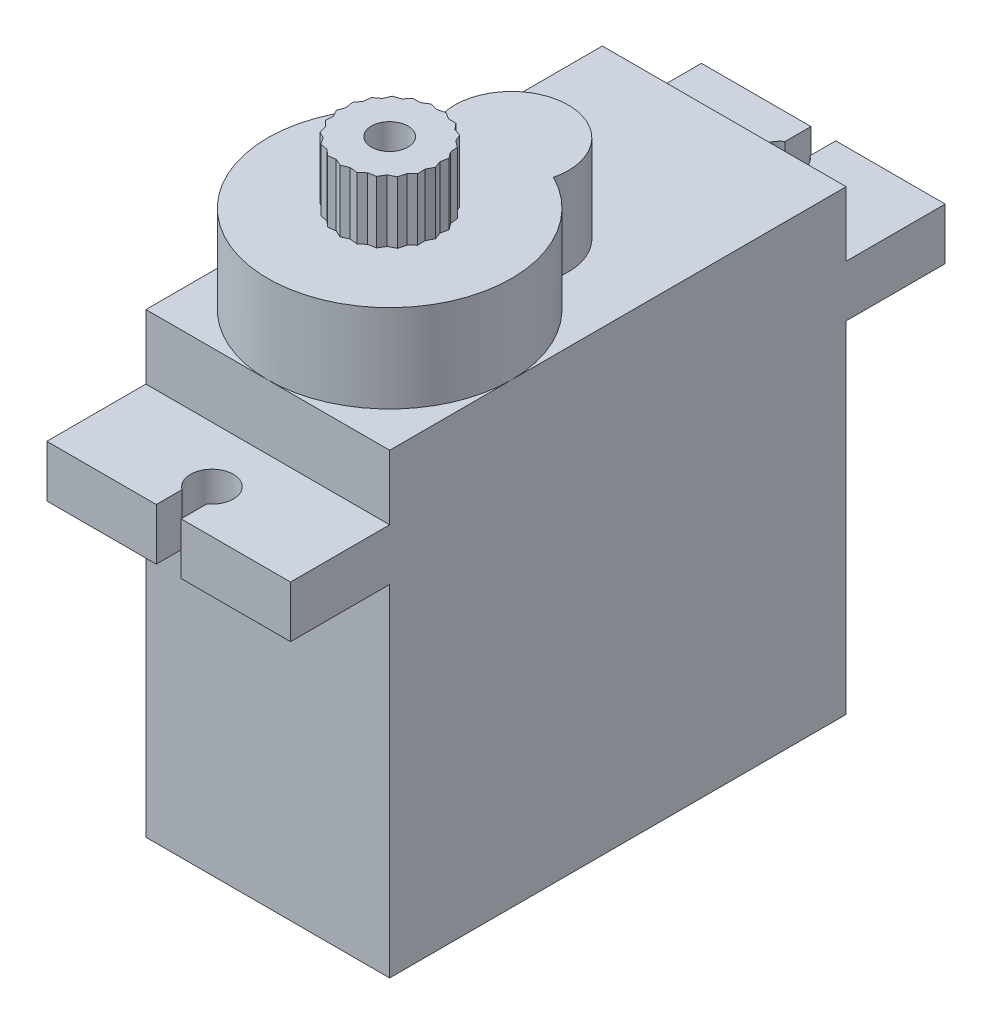
from build123d import *

# Parameters (mm, degrees)
BOSS_EXTRUDE1_DEPTH = 5.9944
BOSS_EXTRUDE2_DEPTH = 4.318
BOSS_EXTRUDE3_DEPTH = 3.048
CIRPATTERN1_COUNT   = 21
SKETCH4_R           = 0.9
CUT_EXTRUDE1_DEPTH  = 6
CUT_EXTRUDE2_REACH  = 35.989


with BuildPart() as part:
    # Sketch1 → Boss-Extrude1 (new, symmetric)
    with BuildSketch(Plane(origin=(0, 0, 0), x_dir=(0, 0, -1), z_dir=(1, 0, 0))):
        Polygon((22.45, 16.764), (27.325, 16.764), (27.325, 19.304), (22.45, 19.304), (22.45, 22.479), (0, 22.479), (0, 19.304), (-4.875, 19.304), (-4.875, 16.764), (0, 16.764), (0, 0), (22.45, 0), align=None)
    extrude(amount=BOSS_EXTRUDE1_DEPTH, both=True)

    # Sketch2 → Boss-Extrude2 (add)
    with BuildSketch(Plane(origin=(0, 22.479, 0), x_dir=(1, 0, 0), z_dir=(0, 1, 0))):
        with BuildLine():
            ThreePointArc((-2.717065955, 11.337655932), (0, 0), (2.717065955, 11.337655932))
            ThreePointArc((2.717065955, 11.337655932), (0, 14.7828), (-2.717065955, 11.337655932))
        make_face()
    extrude(amount=BOSS_EXTRUDE2_DEPTH)

    # Sketch3 → Boss-Extrude3 (add)
    with BuildSketch(Plane(origin=(0, 26.797, 0), x_dir=(1, 0, 0), z_dir=(0, 1, 0))):
        Polygon((0, 5.9944), (0, 8.3058), (0.363424662, 8.405565087), (0.68129711, 8.203110983), align=None)
    boss_extrude3 = extrude(amount=BOSS_EXTRUDE3_DEPTH)

    # CirPattern1: Boss-Extrude3 ×21 about axis
    cirpattern1_axis = Axis((0, 0, -5.9944), (0, 1, 0))
    for i in range(1, CIRPATTERN1_COUNT):
        add(boss_extrude3.rotate(cirpattern1_axis, i * 360 / CIRPATTERN1_COUNT))

    # Sketch4 → Cut-Extrude1 (cut)
    with BuildSketch(Plane(origin=(0, 29.845, 0), x_dir=(1, 0, 0), z_dir=(0, 1, 0))):
        with Locations(Location((0, 5.9944, 0), (0, 0, 270))):
            Circle(SKETCH4_R)
    extrude(amount=-CUT_EXTRUDE1_DEPTH, mode=Mode.SUBTRACT)

    # Sketch5 → Cut-Extrude2 (cut, up to next)
    with BuildSketch(Plane(origin=(0, 19.304, 0), x_dir=(1, 0, 0), z_dir=(0, 1, 0)), mode=Mode.PRIVATE) as cut_extrude2_sk1:
        with BuildLine():
            Line((-0.6096, 26.054950376), (-0.6096, 27.325))
            Line((-0.6096, 27.325), (0.6096, 27.325))
            Line((0.6096, 27.325), (0.6096, 26.054950376))
            ThreePointArc((0.6096, 26.054950376), (0, 24.1409), (-0.6096, 26.054950376))
        make_face()
    cut_extrude2_tool1 = extrude(cut_extrude2_sk1.sketch, amount=-CUT_EXTRUDE2_REACH, mode=Mode.PRIVATE) & part.part
    # Sketch5 → Cut-Extrude2 (cut, up to next)
    with BuildSketch(Plane(origin=(0, 19.304, 0), x_dir=(1, 0, 0), z_dir=(0, 1, 0)), mode=Mode.PRIVATE) as cut_extrude2_sk2:
        with BuildLine():
            Line((-0.6096, -4.875), (0.6096, -4.875))
            Line((0.6096, -4.875), (0.6096, -3.604950376))
            ThreePointArc((0.6096, -3.604950376), (0, -1.6909), (-0.6096, -3.604950376))
            Line((-0.6096, -3.604950376), (-0.6096, -4.875))
        make_face()
    cut_extrude2_tool2 = extrude(cut_extrude2_sk2.sketch, amount=-CUT_EXTRUDE2_REACH, mode=Mode.PRIVATE) & part.part
    add(cut_extrude2_tool1.solids().sort_by_distance((0, 19.304, -25.638579))[0], mode=Mode.SUBTRACT)
    add(cut_extrude2_tool2.solids().sort_by_distance((0, 19.304, 3.188579))[0], mode=Mode.SUBTRACT)


solid = part.part
